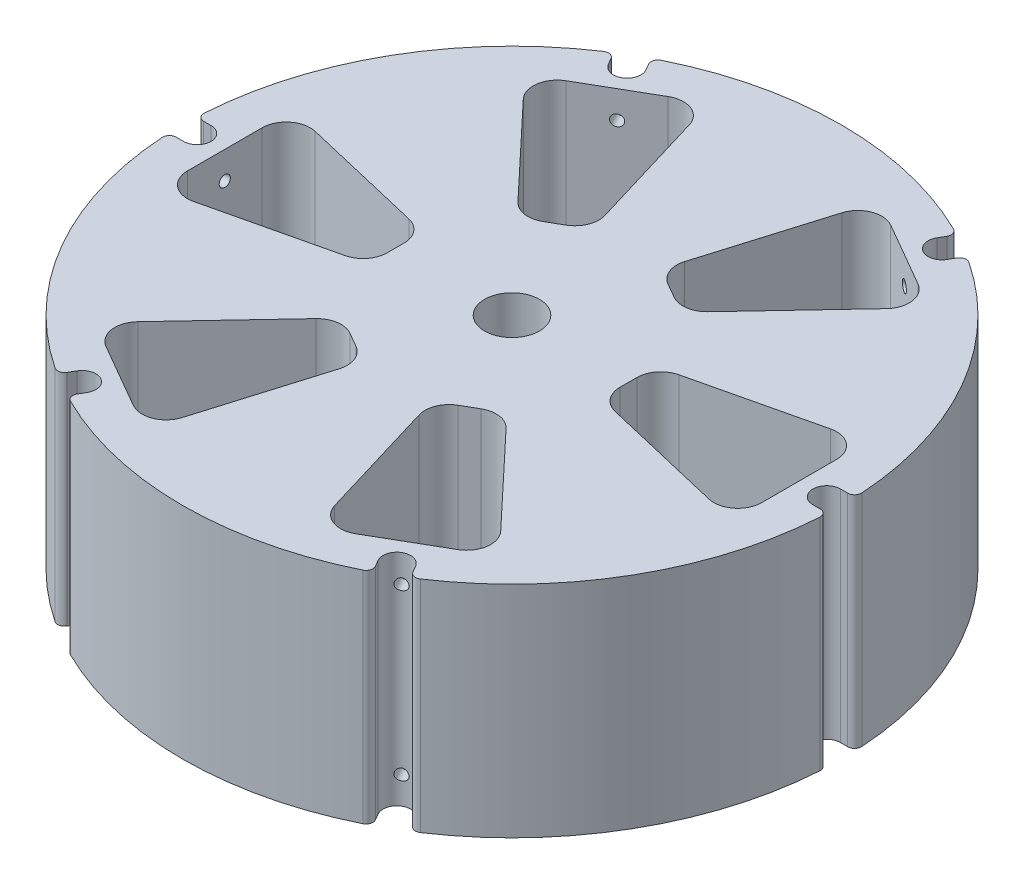
from build123d import *

# Parameters (mm, degrees)
SKETCH1_R                 = 76.2
SKETCH1_R_2               = 14.224
BOSS_EXTRUDE1_DEPTH       = 25.4
CUT_EXTRUDE1_DEPTH        = 120.1365603
CUT_EXTRUDE2_DEPTH        = 120.1365603
F_5_40_TAPPED_HOLE1_D     = 2.5781
F_5_40_TAPPED_HOLE1_DEPTH = 9.712825433
FILLET1_R                 = 1.5875
FILLET2_R                 = 5.55625
CIRPATTERN1_COUNT         = 6
CIRPATTERN1_COPY_1_D      = 2.5781
CIRPATTERN1_COPY_1_DEPTH  = 9.712825433
CIRPATTERN1_COPY_2_D      = 2.5781
CIRPATTERN1_COPY_2_DEPTH  = 9.712825433
CIRPATTERN1_COPY_3_D      = 2.5781
CIRPATTERN1_COPY_3_DEPTH  = 9.712825433
CIRPATTERN1_COPY_4_D      = 2.5781
CIRPATTERN1_COPY_4_DEPTH  = 9.712825433
CIRPATTERN1_COPY_5_D      = 2.5781
CIRPATTERN1_COPY_5_DEPTH  = 9.712825433
FILLET1_OF_CIRPATTERN1_R  = 1.5875
FILLET2_OF_CIRPATTERN1_R  = 5.55625
BOSS_EXTRUDE2_START       = -23.368
SKETCH7_R                 = 14.224
SKETCH7_R_2               = 6.35
BOSS_EXTRUDE2_DEPTH       = 23.368


with BuildPart() as part:
    # Sketch1 → Boss-Extrude1 (new, symmetric)
    with BuildSketch(Plane(origin=(0, 0, 0), x_dir=(1, 0, 0), z_dir=(0, 1, 0))):
        with Locations(Location((0, 0, 0), (0, 0, 270))):
            Circle(SKETCH1_R)
        with Locations(Location((0, 0, 0), (0, 0, 270))):
            Circle(SKETCH1_R_2, mode=Mode.SUBTRACT)
    extrude(amount=BOSS_EXTRUDE1_DEPTH, both=True)

    # Sketch3 → Cut-Extrude1 (cut, through all)
    with BuildSketch(Plane(origin=(0, -25.4, 0), x_dir=(-1, 0, 0), z_dir=(0, -1, 0))):
        with BuildLine():
            Line((-76.133825433, 3.175), (-72.771, 3.175))
            ThreePointArc((-72.771, 3.175), (-69.596, 0), (-72.771, -3.175))
            Line((-72.771, -3.175), (-76.133825433, -3.175))
            ThreePointArc((-76.133825433, -3.175), (-76.2, 0), (-76.133825433, 3.175))
        make_face()
    cut_extrude1 = extrude(amount=-CUT_EXTRUDE1_DEPTH, mode=Mode.SUBTRACT)

    # Sketch4 → Cut-Extrude2 (cut, through all)
    with BuildSketch(Plane(origin=(0, -25.4, 0), x_dir=(-1, 0, 0), z_dir=(0, -1, 0))):
        Polygon((-66.421, 15.665330189), (-66.421, -15.665330189), (-26.924, -6.35), (-26.924, 6.35), align=None)
    cut_extrude2 = extrude(amount=-CUT_EXTRUDE2_DEPTH, mode=Mode.SUBTRACT)

    # #5-40 Tapped Hole1
    with Locations(Plane.ZY.offset(-66.421)):
        with Locations((0, -19.05)):
            f_5_40_tapped_hole1 = Hole(F_5_40_TAPPED_HOLE1_D / 2, depth=F_5_40_TAPPED_HOLE1_DEPTH)

    # Fillet1
    fillet1_edges = [part.edges().sort_by_distance(p)[0] for p in [
        (76.133825433, 0, 3.175),
        (76.133825433, 0, -3.175),
    ]]
    fillet(fillet1_edges, radius=FILLET1_R)

    # Fillet2
    fillet2_edges = [part.edges().sort_by_distance(p)[0] for p in [
        (66.421, 0, -15.665330189),
        (26.924, 0, -6.35),
        (26.924, 0, 6.35),
        (66.421, 0, 15.665330189),
    ]]
    fillet(fillet2_edges, radius=FILLET2_R)

    # Mirror1: #5-40 Tapped Hole1 across plane
    add(f_5_40_tapped_hole1.mirror(Plane.ZX), mode=Mode.SUBTRACT)

    # CirPattern1: Cut-Extrude1, Cut-Extrude2, #5-40 Tapped Hole1 ×6 about axis
    cirpattern1_axis = Axis((0, 0, 0), (0, 1, 0))
    add([cut_extrude1.rotate(cirpattern1_axis, i * 360 / CIRPATTERN1_COUNT) for i in range(1, CIRPATTERN1_COUNT)], mode=Mode.SUBTRACT)
    add([cut_extrude2.rotate(cirpattern1_axis, i * 360 / CIRPATTERN1_COUNT) for i in range(1, CIRPATTERN1_COUNT)], mode=Mode.SUBTRACT)
    add([f_5_40_tapped_hole1.rotate(cirpattern1_axis, i * 360 / CIRPATTERN1_COUNT) for i in range(1, CIRPATTERN1_COUNT)], mode=Mode.SUBTRACT)

    # CirPattern1 copy 1
    with Locations(Plane(origin=(33.2105, 0, -57.522273345), x_dir=(0.8660254037844386, 0, 0.5000000000000001), z_dir=(-0.5000000000000001, 0, 0.8660254037844386))):
        with Locations((0, 19.05)):
            Hole(CIRPATTERN1_COPY_1_D / 2, depth=CIRPATTERN1_COPY_1_DEPTH)

    # CirPattern1 copy 2
    with Locations(Plane(origin=(-33.2105, 0, -57.522273345), x_dir=(0.8660254037844387, 0, -0.4999999999999998), z_dir=(0.4999999999999998, 0, 0.8660254037844387))):
        with Locations((0, 19.05)):
            Hole(CIRPATTERN1_COPY_2_D / 2, depth=CIRPATTERN1_COPY_2_DEPTH)

    # CirPattern1 copy 3
    with Locations(Plane(origin=(-66.421, 0, 0), x_dir=(0, 0, -1), z_dir=(1, 0, 0))):
        with Locations((0, 19.05)):
            Hole(CIRPATTERN1_COPY_3_D / 2, depth=CIRPATTERN1_COPY_3_DEPTH)

    # CirPattern1 copy 4
    with Locations(Plane(origin=(-33.2105, 0, 57.522273345), x_dir=(-0.8660254037844384, 0, -0.5000000000000004), z_dir=(0.5000000000000004, 0, -0.8660254037844384))):
        with Locations((0, 19.05)):
            Hole(CIRPATTERN1_COPY_4_D / 2, depth=CIRPATTERN1_COPY_4_DEPTH)

    # CirPattern1 copy 5
    with Locations(Plane(origin=(33.2105, 0, 57.522273345), x_dir=(-0.8660254037844386, 0, 0.5000000000000001), z_dir=(-0.5000000000000001, 0, -0.8660254037844386))):
        with Locations((0, 19.05)):
            Hole(CIRPATTERN1_COPY_5_D / 2, depth=CIRPATTERN1_COPY_5_DEPTH)

    # Fillet1 of CirPattern1
    fillet1_of_cirpattern1_edges = [part.edges().sort_by_distance(p)[0] for p in [
        (40.816543373, 0, -64.346326912),
        (35.317282059, 0, -67.521326912),
        (-35.317282059, 0, -67.521326912),
        (-40.816543373, 0, -64.346326912),
        (-76.133825433, 0, -3.175),
        (-76.133825433, 0, 3.175),
        (-40.816543373, 0, 64.346326912),
        (-35.317282059, 0, 67.521326912),
        (35.317282059, 0, 67.521326912),
        (40.816543373, 0, 64.346326912),
    ]]
    fillet(fillet1_of_cirpattern1_edges, radius=FILLET1_OF_CIRPATTERN1_R)

    # Fillet2 of CirPattern1
    fillet2_of_cirpattern1_edges = [part.edges().sort_by_distance(p)[0] for p in [
        (19.643926098, 0, -65.354938439),
        (7.962738686, 0, -26.491867971),
        (18.961261314, 0, -20.141867971),
        (46.777073902, 0, -49.68960825),
        (-46.777073902, 0, -49.68960825),
        (-18.961261314, 0, -20.141867971),
        (-7.962738686, 0, -26.491867971),
        (-19.643926098, 0, -65.354938439),
        (-66.421, 0, 15.665330189),
        (-26.924, 0, 6.35),
        (-26.924, 0, -6.35),
        (-66.421, 0, -15.665330189),
        (-19.643926098, 0, 65.354938439),
        (-7.962738686, 0, 26.491867971),
        (-18.961261314, 0, 20.141867971),
        (-46.777073902, 0, 49.68960825),
        (46.777073902, 0, 49.68960825),
        (18.961261314, 0, 20.141867971),
        (7.962738686, 0, 26.491867971),
        (19.643926098, 0, 65.354938439),
    ]]
    fillet(fillet2_of_cirpattern1_edges, radius=FILLET2_OF_CIRPATTERN1_R)

    # Sketch7 → Boss-Extrude2 (add)
    with BuildSketch(Plane(origin=(0, 25.4, 0), x_dir=(1, 0, 0), z_dir=(0, 1, 0)).offset(BOSS_EXTRUDE2_START)):
        with Locations(Location((0, 0, 0), (0, 0, 270))):
            Circle(SKETCH7_R)
        with Locations(Location((0, 0, 0), (0, 0, 270))):
            Circle(SKETCH7_R_2, mode=Mode.SUBTRACT)
    extrude(amount=BOSS_EXTRUDE2_DEPTH)


solid = part.part
